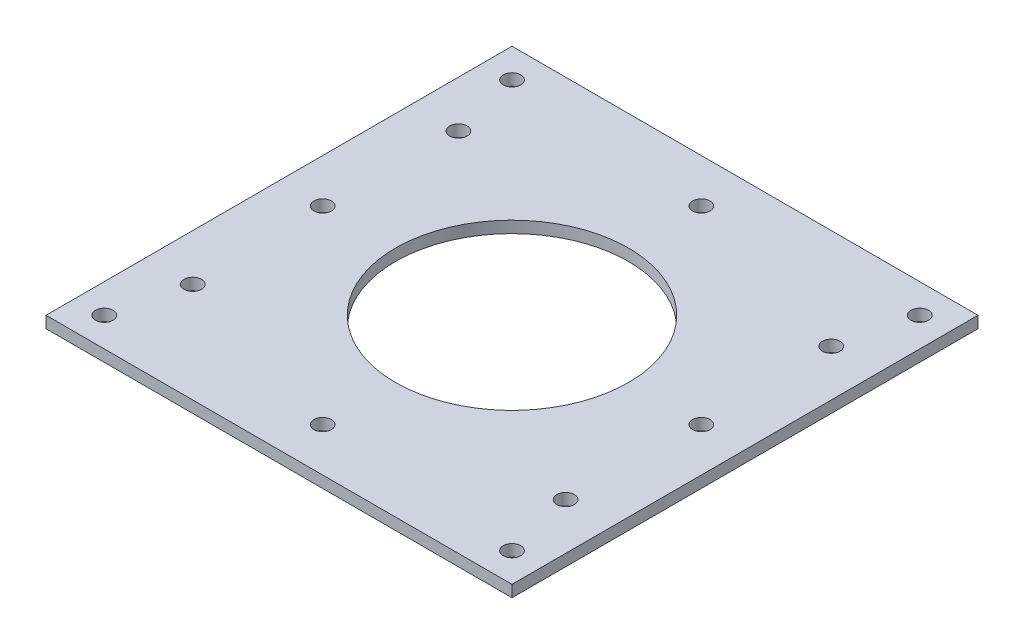
from build123d import *

# Parameters (mm, degrees)
SKETCH1_W           = 80
SKETCH1_H           = 80
BOSS_EXTRUDE1_DEPTH = 2
SKETCH4_R           = 1.5
CUT_EXTRUDE3_DEPTH  = 114.154761279
SKETCH6_R           = 1.5
CUT_EXTRUDE4_DEPTH  = 114.154761279
SKETCH8_R           = 20
SKETCH8_R_2         = 1.5
CUT_EXTRUDE6_DEPTH  = 114.154761279


with BuildPart() as part:
    # Sketch1 → Boss-Extrude1 (new body)
    with BuildSketch(Plane(origin=(0, 0, 0), x_dir=(1, 0, 0), z_dir=(0, 1, 0))):
        with Locations((40, 40)):
            Rectangle(SKETCH1_W, SKETCH1_H)
    extrude(amount=BOSS_EXTRUDE1_DEPTH)

    # Sketch4 → Cut-Extrude3 (cut, through all)
    with BuildSketch(Plane.XZ):
        with Locations(Location((5, -5, 0), (0, 0, 270))):
            Circle(SKETCH4_R)
        with Locations(Location((75, -5, 0), (0, 0, 90))):
            Circle(SKETCH4_R)
        with Locations(Location((75, -75, 0), (0, 0, 270))):
            Circle(SKETCH4_R)
        with Locations(Location((5, -75, 0), (0, 0, 90))):
            Circle(SKETCH4_R)
    extrude(amount=-CUT_EXTRUDE3_DEPTH, mode=Mode.SUBTRACT)

    # Sketch6 → Cut-Extrude4 (cut, through all)
    with BuildSketch(Plane(origin=(0, 2, 0), x_dir=(1, 0, 0), z_dir=(0, 1, 0))):
        with Locations(Location((8, 17.2, 0), (0, 0, 270))):
            Circle(SKETCH6_R)
        with Locations(Location((72, 17.2, 0), (0, 0, 270))):
            Circle(SKETCH6_R)
    cut_extrude4 = extrude(amount=-CUT_EXTRUDE4_DEPTH, mode=Mode.SUBTRACT)

    # Mirror1: Cut-Extrude4 across plane
    add(cut_extrude4.mirror(Plane.XY.offset(-40)), mode=Mode.SUBTRACT)

    # Sketch8 → Cut-Extrude6 (cut, through all)
    with BuildSketch(Plane(origin=(0, 2, 0), x_dir=(1, 0, 0), z_dir=(0, 1, 0))):
        with Locations(Location((40, 40, 0), (0, 0, 270))):
            Circle(SKETCH8_R)
        with Locations(Location((40, 72.5, 0), (0, 0, 270))):
            Circle(SKETCH8_R_2)
        with Locations(Location((72.5, 40, 0), (0, 0, 270))):
            Circle(SKETCH8_R_2)
        with Locations(Location((40, 7.5, 0), (0, 0, 270))):
            Circle(SKETCH8_R_2)
        with Locations(Location((7.5, 40, 0), (0, 0, 270))):
            Circle(SKETCH8_R_2)
    extrude(amount=-CUT_EXTRUDE6_DEPTH, mode=Mode.SUBTRACT)


solid = part.part
